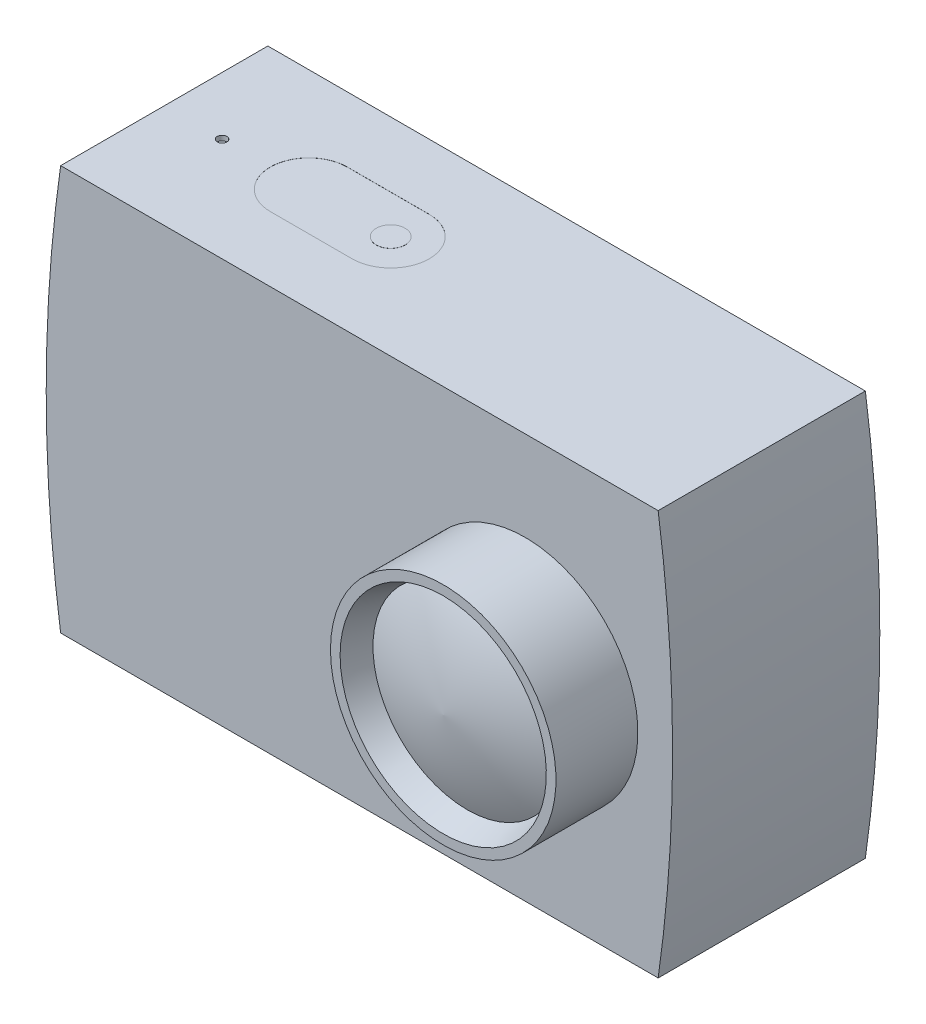
from build123d import *

# Parameters (mm, degrees)
SALIENTE_EXTRUIR1_DEPTH = 21.5
CORTAR_EXTRUIR1_DEPTH   = 0.01
CROQUIS3_R              = 1.5
SALIENTE_EXTRUIR2_DEPTH = 0.01
CROQUIS4_R              = 0.5
CORTAR_EXTRUIR2_DEPTH   = 0.5


with BuildPart() as part:
    # Croquis1 → Saliente-Extruir1 (new body)
    with BuildSketch(Plane.XY):
        with BuildLine():
            Line((0, 0), (-62, 0))
            ThreePointArc((-62, 0), (-63.497440295, 21), (-62, 42))
            Line((-62, 42), (0, 42))
            ThreePointArc((0, 42), (1.497440295, 21), (0, 0))
        make_face()
    extrude(amount=SALIENTE_EXTRUIR1_DEPTH)

    # Croquis2 → Cortar-Extruir1 (cut)
    with BuildSketch(Plane(origin=(0, 42, 0), x_dir=(1, 0, 0), z_dir=(0, 1, 0))):
        with BuildLine():
            Line((-47, -6.75), (-38.5, -6.75))
            ThreePointArc((-38.5, -6.75), (-34.5, -10.75), (-38.5, -14.75))
            Line((-38.5, -14.75), (-47, -14.75))
            ThreePointArc((-47, -14.75), (-51, -10.75), (-47, -6.75))
        make_face()
    extrude(amount=-CORTAR_EXTRUIR1_DEPTH, mode=Mode.SUBTRACT)

    # Croquis3 → Saliente-Extruir2 (add)
    with BuildSketch(Plane(origin=(0, 41.99, 0), x_dir=(1, 0, 0), z_dir=(0, 1, 0))):
        with Locations(Location((-38.5, -10.75, 0), (0, 0, 90))):
            Circle(CROQUIS3_R)
    extrude(amount=SALIENTE_EXTRUIR2_DEPTH)

    # Croquis4 → Cortar-Extruir2 (cut)
    with BuildSketch(Plane(origin=(0, 42, 0), x_dir=(1, 0, 0), z_dir=(0, 1, 0))):
        with Locations(Location((-56, -10.75, 0), (0, 0, 270))):
            Circle(CROQUIS4_R)
    extrude(amount=-CORTAR_EXTRUIR2_DEPTH, mode=Mode.SUBTRACT)

    # Croquis6 → Revolución1 (revolve)
    with BuildSketch(Plane(origin=(0, 21, 0), x_dir=(-1, 0, 0), z_dir=(0, -1, 0))):
        Polygon((25.502559705, -21.5), (25.502559705, -30), (24.502559705, -30), (23.592634119, -27.5), (22.592634119, -27.5), (13.802559705, -27.5), (13.802559705, -21.5), align=None)
    revolve(axis=Axis((-13.802559705, 21, 21.5), (0, 0, 1)))

    # Croquis9 → Revolución3 (revolve)
    with BuildSketch(Plane(origin=(0, 21, 0), x_dir=(1, 0, 0), z_dir=(0, 1, 0)), mode=Mode.PRIVATE) as revoluci_n3_sk:
        with BuildLine():
            Line((-13.802559705, -27.5), (-13.802559705, -30))
            ThreePointArc((-13.802559705, -30), (-18.810632516, -29.192650791), (-23.592634119, -27.5))
            Line((-23.592634119, -27.5), (-13.802559705, -27.5))
        make_face()
    revolve(revoluci_n3_sk.sketch.rotate(Axis((-13.802559705, 21, 27.5), (0, 0, 1)), 270), axis=Axis((-13.802559705, 21, 27.5), (0, 0, 1)))


solid = part.part
